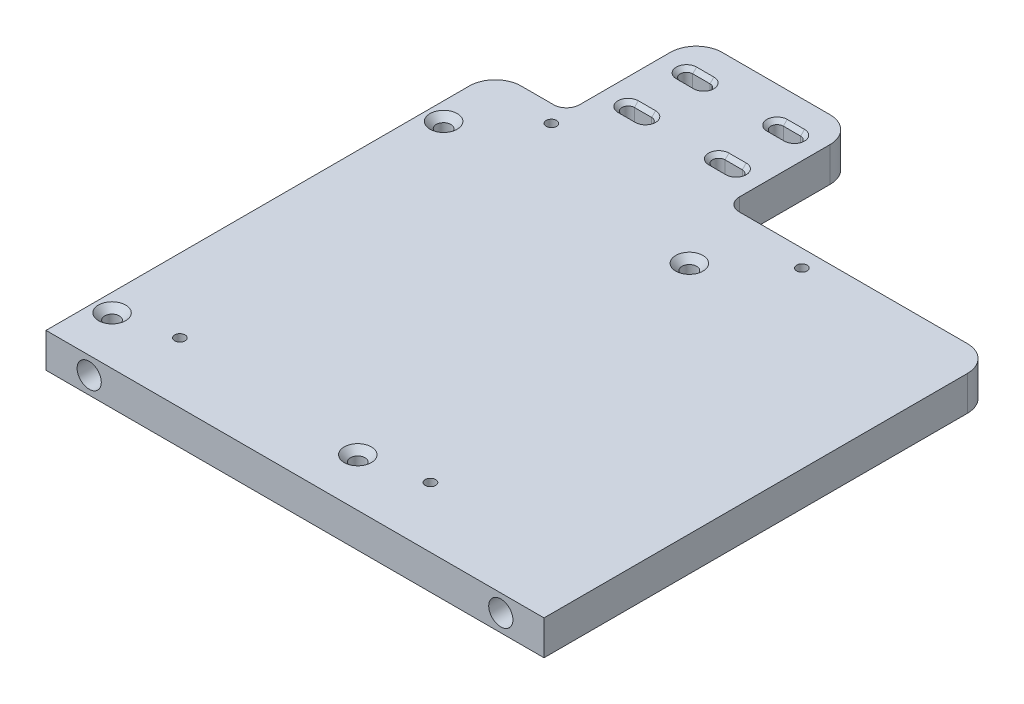
from build123d import *

# Parameters (mm, degrees)
SKETCH2_W                                       = 115.292618629
SKETCH2_H                                       = 134.000000002
BOSS_EXTRUDE2_DEPTH                             = 8
FILLET2_R                                       = 6
CSK_FOR_M2_FLAT_HEAD_MACHINE_SCREW2_D           = 2.4
CSK_FOR_M2_FLAT_HEAD_MACHINE_SCREW2_CSINK_D     = 4.4
CSK_FOR_M2_FLAT_HEAD_MACHINE_SCREW2_CSINK_ANGLE = 90
CSK_FOR_M3_FLAT_HEAD_MACHINE_SCREW1_D           = 3.4
CSK_FOR_M3_FLAT_HEAD_MACHINE_SCREW1_CSINK_D     = 6.3
CSK_FOR_M3_FLAT_HEAD_MACHINE_SCREW1_CSINK_ANGLE = 90
SKETCH19_W                                      = 8
SKETCH19_H                                      = 99
BOSS_EXTRUDE3_DEPTH                             = 115.292618629
SKETCH21_W                                      = 135.292618629
SKETCH21_H                                      = 129
SKETCH21_W_2                                    = 115.292618629
SKETCH21_H_2                                    = 99
BOSS_EXTRUDE4_DEPTH                             = 8
FILLET3_R                                       = 5
CUT_EXTRUDE1_DEPTH                              = 4
SKETCH24_W                                      = 115.292618629
SKETCH24_H                                      = 10
BOSS_EXTRUDE5_DEPTH                             = 104
FILLET4_R                                       = 6
M2_5_CLEARANCE_HOLE1_D                          = 2.9
CUT_EXTRUDE4_START                              = -8
CUT_EXTRUDE4_DEPTH                              = 8
CHAMFER1_SIZE                                   = 0.9
SKETCH61_W                                      = 104
SKETCH61_H                                      = 10
CUT_EXTRUDE6_DEPTH                              = 115.292618629
SKETCH62_W                                      = 8
SKETCH62_H                                      = 129
CUT_EXTRUDE7_DEPTH                              = 135.292618629
F_5_6_5_6_DIAMETER_HOLE1_D                      = 5.6
F_5_6_5_6_DIAMETER_HOLE1_DEPTH                  = 8
F_5_6_5_6_DIAMETER_HOLE1_TIP                    = 1.682409733
SKETCH66_W                                      = 61.79
SKETCH66_H                                      = 30.000000002
CUT_EXTRUDE9_DEPTH                              = 8
SKETCH67_W                                      = 16.522618629
SKETCH67_H                                      = 30.000000002
CUT_EXTRUDE10_DEPTH                             = 8
FILLET5_R                                       = 6
FILLET6_R                                       = 3


with BuildPart() as part:
    # Sketch2 → Boss-Extrude2 (new body)
    with BuildSketch(Plane(origin=(0, 0, 0), x_dir=(1, 0, 0), z_dir=(0, 1, 0))):
        with Locations((4.853690686, 42.889279439)):
            Rectangle(SKETCH2_W, SKETCH2_H)
    extrude(amount=BOSS_EXTRUDE2_DEPTH)

    # Fillet2
    fillet2_edges = [part.edges().sort_by_distance(p)[0] for p in [
        (-52.792618629, 4, -109.88927944),
        (62.5, 4, -109.88927944),
    ]]
    fillet(fillet2_edges, radius=FILLET2_R)

    # CSK for M2 Flat Head Machine Screw2 (through all)
    with Locations(Plane(origin=(0, 0, 0), x_dir=(-1, 0, 0), z_dir=(0, -1, 0))):
        with Locations((-22.207381371, 75.889279438), (35.792618629, 75.889279438), (35.792618629, -10.110720562), (-22.207381371, -10.110720562)):
            CounterSinkHole(CSK_FOR_M2_FLAT_HEAD_MACHINE_SCREW2_D / 2, CSK_FOR_M2_FLAT_HEAD_MACHINE_SCREW2_CSINK_D / 2, counter_sink_angle=CSK_FOR_M2_FLAT_HEAD_MACHINE_SCREW2_CSINK_ANGLE)

    # CSK for M3 Flat Head Machine Screw1 (through all)
    with Locations(Plane(origin=(0, 8, 0), x_dir=(1, 0, 0), z_dir=(0, 1, 0))):
        with Locations((-48.662618629, 63.809279438), (8.227381371, 63.809279438), (8.227381371, -12.950720562), (-48.662618629, -12.950720562)):
            CounterSinkHole(CSK_FOR_M3_FLAT_HEAD_MACHINE_SCREW1_D / 2, CSK_FOR_M3_FLAT_HEAD_MACHINE_SCREW1_CSINK_D / 2, counter_sink_angle=CSK_FOR_M3_FLAT_HEAD_MACHINE_SCREW1_CSINK_ANGLE)

    # Sketch19 → Boss-Extrude3 (add)
    with BuildSketch(Plane.ZY.offset(52.792618629)):
        with Locations((28.110720562, 13.5)):
            Rectangle(SKETCH19_W, SKETCH19_H)
    extrude(amount=-BOSS_EXTRUDE3_DEPTH)

    # Sketch21 → Boss-Extrude4 (add)
    with BuildSketch(Plane.XY.offset(32.110720562)):
        with Locations((4.853690685, 8.5)):
            Rectangle(SKETCH21_W, SKETCH21_H)
        with Locations((4.853690686, 13.5)):
            Rectangle(SKETCH21_W_2, SKETCH21_H_2, mode=Mode.SUBTRACT)
    extrude(amount=-BOSS_EXTRUDE4_DEPTH)

    # Fillet3
    fillet3_edges = [part.edges().sort_by_distance(p)[0] for p in [
        (72.5, 73, 28.110720562),
        (72.5, -56, 28.110720562),
        (-62.792618629, -56, 28.110720562),
        (-62.792618629, 73, 28.110720562),
    ]]
    fillet(fillet3_edges, radius=FILLET3_R)

    # Sketch22 → Cut-Extrude1 (cut)
    with BuildSketch(Plane(origin=(0, 0, 24.110720562), x_dir=(-1, 0, 0), z_dir=(0, 0, -1))):
        with BuildLine():
            Line((62.792618629, -51), (62.792618629, 68))
            ThreePointArc((62.792618629, 68), (61.328152535, 71.535533906), (57.792618629, 73))
            Line((57.792618629, 73), (-67.5, 73))
            ThreePointArc((-67.5, 73), (-71.035533906, 71.535533906), (-72.5, 68))
            Line((-72.5, 68), (-72.5, -51))
            ThreePointArc((-72.5, -51), (-71.035533906, -54.535533906), (-67.5, -56))
            Line((-67.5, -56), (57.792618629, -56))
            ThreePointArc((57.792618629, -56), (61.328152535, -54.535533906), (62.792618629, -51))
        make_face()
        with BuildLine():
            Line((57.792618629, 69.75), (-67.5, 69.75))
            ThreePointArc((-67.5, 69.75), (-68.737436867, 69.237436867), (-69.25, 68))
            Line((-69.25, 68), (-69.25, -51))
            ThreePointArc((-69.25, -51), (-68.737436867, -52.237436867), (-67.5, -52.75))
            Line((-67.5, -52.75), (57.792618629, -52.75))
            ThreePointArc((57.792618629, -52.75), (59.030055496, -52.237436867), (59.542618629, -51))
            Line((59.542618629, -51), (59.542618629, 68))
            ThreePointArc((59.542618629, 68), (59.030055496, 69.237436867), (57.792618629, 69.75))
        make_face(mode=Mode.SUBTRACT)
    extrude(amount=-CUT_EXTRUDE1_DEPTH, mode=Mode.SUBTRACT)

    # Sketch24 → Boss-Extrude5 (add)
    with BuildSketch(Plane(origin=(0, 0, 24.110720562), x_dir=(-1, 0, 0), z_dir=(0, 0, -1))):
        with Locations((-4.853690686, 60)):
            Rectangle(SKETCH24_W, SKETCH24_H)
    extrude(amount=BOSS_EXTRUDE5_DEPTH)

    # Fillet4
    fillet4_edges = [part.edges().sort_by_distance(p)[0] for p in [
        (62.5, 60, -79.889279438),
        (-52.792618629, 60, -79.889279438),
    ]]
    fillet(fillet4_edges, radius=FILLET4_R)

    # M2.5 Clearance Hole1 (through all)
    with Locations(Plane(origin=(0, 8, 0), x_dir=(1, 0, 0), z_dir=(0, 1, 0))):
        with Locations((-28.27, 101.64), (-7.29, 101.64), (-7.29, 88.14), (-28.27, 88.14)):
            Hole(M2_5_CLEARANCE_HOLE1_D / 2)

    # Sketch60 → Cut-Extrude4 (cut)
    with BuildSketch(Plane(origin=(0, 8, 0), x_dir=(1, 0, 0), z_dir=(0, 1, 0)).offset(CUT_EXTRUDE4_START)):
        with BuildLine():
            Line((-30.27, 103.09), (-26.27, 103.09))
            ThreePointArc((-26.27, 103.09), (-24.82, 101.64), (-26.27, 100.19))
            Line((-26.27, 100.19), (-30.27, 100.19))
            ThreePointArc((-30.27, 100.19), (-31.72, 101.64), (-30.27, 103.09))
        make_face()
        with BuildLine():
            Line((-9.29, 103.09), (-5.29, 103.09))
            ThreePointArc((-5.29, 103.09), (-3.84, 101.64), (-5.29, 100.19))
            Line((-5.29, 100.19), (-9.29, 100.19))
            ThreePointArc((-9.29, 100.19), (-10.74, 101.64), (-9.29, 103.09))
        make_face()
        with BuildLine():
            Line((-30.27, 89.59), (-26.27, 89.59))
            ThreePointArc((-26.27, 89.59), (-24.82, 88.14), (-26.27, 86.69))
            Line((-26.27, 86.69), (-30.27, 86.69))
            ThreePointArc((-30.27, 86.69), (-31.72, 88.14), (-30.27, 89.59))
        make_face()
        with BuildLine():
            Line((-9.29, 89.59), (-5.29, 89.59))
            ThreePointArc((-5.29, 89.59), (-3.84, 88.14), (-5.29, 86.69))
            Line((-5.29, 86.69), (-9.29, 86.69))
            ThreePointArc((-9.29, 86.69), (-10.74, 88.14), (-9.29, 89.59))
        make_face()
    extrude(amount=CUT_EXTRUDE4_DEPTH, mode=Mode.SUBTRACT)

    # Chamfer1
    chamfer1_edges = [part.edges().sort_by_distance(p)[0] for p in [
        (-7.29, 8, -100.19),
        (-3.84, 8, -101.64),
        (-7.29, 8, -103.09),
        (-28.27, 8, -86.69),
        (-24.82, 8, -88.14),
        (-28.27, 8, -89.59),
        (-7.29, 8, -86.69),
        (-3.84, 8, -88.14),
        (-7.29, 8, -89.59),
        (-28.27, 8, -103.09),
        (-31.72, 8, -101.64),
        (-28.27, 8, -100.19),
        (-24.82, 8, -101.64),
        (-10.74, 8, -88.14),
        (-31.72, 8, -88.14),
        (-10.74, 8, -101.64),
    ]]
    chamfer(chamfer1_edges, length=CHAMFER1_SIZE)

    # Sketch61 → Cut-Extrude6 (cut)
    with BuildSketch(Plane.ZY.offset(52.792618629)):
        with Locations((-27.889279438, 60)):
            Rectangle(SKETCH61_W, SKETCH61_H)
    extrude(amount=-CUT_EXTRUDE6_DEPTH, mode=Mode.SUBTRACT)

    # Sketch62 → Cut-Extrude7 (cut)
    with BuildSketch(Plane.ZY.offset(62.792618629)):
        with Locations((28.110720562, 8.5)):
            Rectangle(SKETCH62_W, SKETCH62_H)
    extrude(amount=-CUT_EXTRUDE7_DEPTH, mode=Mode.SUBTRACT)

    # Ø5.6 (5.6) Diameter Hole1
    with Locations(Plane.XY.offset(24.110720562)):
        with Locations((-42.792618629, 4), (52.5, 4)):
            Hole(F_5_6_5_6_DIAMETER_HOLE1_D / 2, depth=F_5_6_5_6_DIAMETER_HOLE1_DEPTH)
            with Locations((0, 0, -(F_5_6_5_6_DIAMETER_HOLE1_DEPTH + F_5_6_5_6_DIAMETER_HOLE1_TIP / 2))):  # 118° drill point
                Cone(0, F_5_6_5_6_DIAMETER_HOLE1_D / 2, F_5_6_5_6_DIAMETER_HOLE1_TIP, mode=Mode.SUBTRACT)

    # Sketch66 → Cut-Extrude9 (cut)
    with BuildSketch(Plane.XZ):
        with Locations((31.605, -94.889279439)):
            Rectangle(SKETCH66_W, SKETCH66_H)
    extrude(amount=-CUT_EXTRUDE9_DEPTH, mode=Mode.SUBTRACT)

    # Sketch67 → Cut-Extrude10 (cut)
    with BuildSketch(Plane(origin=(0, 0, 0), x_dir=(-1, 0, 0), z_dir=(0, -1, 0))):
        with Locations((44.531309315, 94.889279439)):
            Rectangle(SKETCH67_W, SKETCH67_H)
    extrude(amount=-CUT_EXTRUDE10_DEPTH, mode=Mode.SUBTRACT)

    # Fillet5
    fillet5_edges = [part.edges().sort_by_distance(p)[0] for p in [
        (62.5, 4, -79.889279438),
        (0.71, 4, -109.88927944),
        (-36.27, 4, -109.88927944),
        (-52.792618629, 4, -79.889279438),
    ]]
    fillet(fillet5_edges, radius=FILLET5_R)

    # Fillet6
    fillet6_edges = [part.edges().sort_by_distance(p)[0] for p in [
        (0.71, 4, -79.889279438),
        (-36.27, 4, -79.889279438),
    ]]
    fillet(fillet6_edges, radius=FILLET6_R)


solid = part.part
